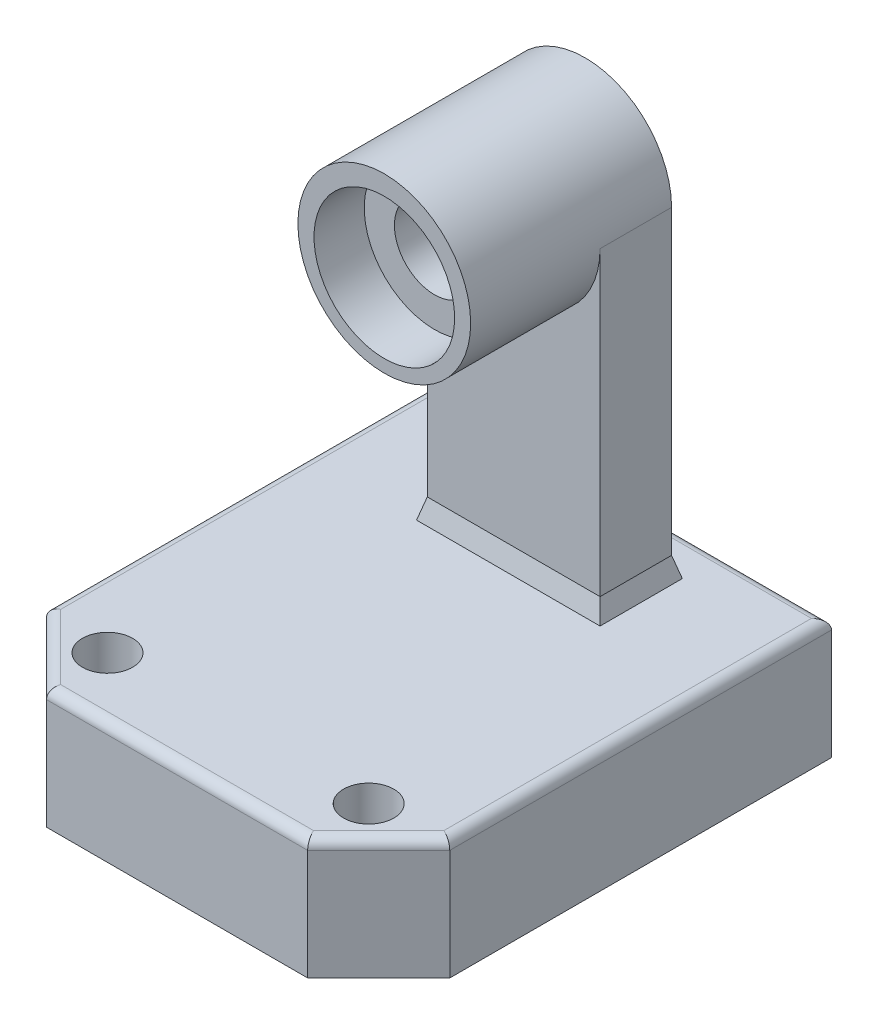
from build123d import *

# Parameters (mm, degrees)
BOSS_EXTRUDE1_DEPTH = 12
FILLET1_R           = 1
SKETCH2_W           = 18.269103957
SKETCH2_H           = 8.189598326
BOSS_EXTRUDE2_DEPTH = 2
BOSS_EXTRUDE2_TAPER = 15
SKETCH4_W           = 17.197307187
SKETCH4_H           = 7.117801556
BOSS_EXTRUDE3_DEPTH = 30
SKETCH5_R           = 2.5
CUT_EXTRUDE1_DEPTH  = 8
SKETCH6_R           = 8.598653593
BOSS_EXTRUDE4_DEPTH = 20
SKETCH7_R           = 7
SKETCH7_R_2         = 3.99890548
CUT_EXTRUDE2_DEPTH  = 5
SKETCH8_R           = 3.99890548
CUT_EXTRUDE3_DEPTH  = 71.566063032


with BuildPart() as part:
    # Sketch1 → Boss-Extrude1 (new body)
    with BuildSketch(Plane(origin=(0, 0, 0), x_dir=(1, 0, 0), z_dir=(0, 1, 0))):
        Polygon((0, -38), (7.071067812, -45.071067812), (33.071067812, -45.071067812), (40.142135624, -38), (40.142135624, 0), (0, 0), align=None)
    extrude(amount=BOSS_EXTRUDE1_DEPTH)

    # Fillet1
    fillet1_edges = [part.edges().sort_by_distance(p)[0] for p in [
        (20.071067812, 12, 45.071067812),
        (36.606601718, 12, 41.535533906),
        (40.142135624, 12, 19),
        (20.071067812, 12, 0),
        (0, 12, 19),
        (3.535533906, 12, 41.535533906),
    ]]
    fillet(fillet1_edges, radius=FILLET1_R)

    # Sketch2 → Boss-Extrude2 (add)
    with BuildSketch(Plane(origin=(0, 12, 0), x_dir=(1, 0, 0), z_dir=(0, 1, 0))):
        with Locations((20.14981395, -8.08561763)):
            Rectangle(SKETCH2_W, SKETCH2_H)
    extrude(amount=BOSS_EXTRUDE2_DEPTH, taper=BOSS_EXTRUDE2_TAPER)

    # Sketch4 → Boss-Extrude3 (add)
    with BuildSketch(Plane(origin=(0, 14, 0), x_dir=(1, 0, 0), z_dir=(0, 1, 0))):
        with Locations((20.14981395, -8.08561763)):
            Rectangle(SKETCH4_W, SKETCH4_H)
    extrude(amount=BOSS_EXTRUDE3_DEPTH)

    # Sketch5 → Cut-Extrude1 (cut)
    with BuildSketch(Plane(origin=(0, 12, 0), x_dir=(1, 0, 0), z_dir=(0, 1, 0))):
        with Locations(Location((33.071067812, -39, 0), (0, 0, 270))):
            Circle(SKETCH5_R)
        with Locations(Location((7.071067812, -39, 0), (0, 0, 270))):
            Circle(SKETCH5_R)
    extrude(amount=-CUT_EXTRUDE1_DEPTH, mode=Mode.SUBTRACT)

    # Sketch6 → Boss-Extrude4 (add)
    with BuildSketch(Plane(origin=(0, 0, 4.526716852), x_dir=(-1, 0, 0), z_dir=(0, 0, -1))):
        with Locations((-20.14981395, 44)):
            Circle(SKETCH6_R)
    extrude(amount=-BOSS_EXTRUDE4_DEPTH)

    # Sketch7 → Cut-Extrude2 (cut)
    with BuildSketch(Plane.XY.offset(24.526716852)):
        with Locations((20.155228961, 43.666817717)):
            Circle(SKETCH7_R)
        with Locations((20.155228961, 43.666817717)):
            Circle(SKETCH7_R_2, mode=Mode.SUBTRACT)
    extrude(amount=-CUT_EXTRUDE2_DEPTH, mode=Mode.SUBTRACT)

    # Sketch8 → Cut-Extrude3 (cut, through all)
    with BuildSketch(Plane.XY.offset(24.526716852)):
        with Locations((20.155228961, 43.666817717)):
            Circle(SKETCH8_R)
    extrude(amount=-CUT_EXTRUDE3_DEPTH, mode=Mode.SUBTRACT)


solid = part.part
